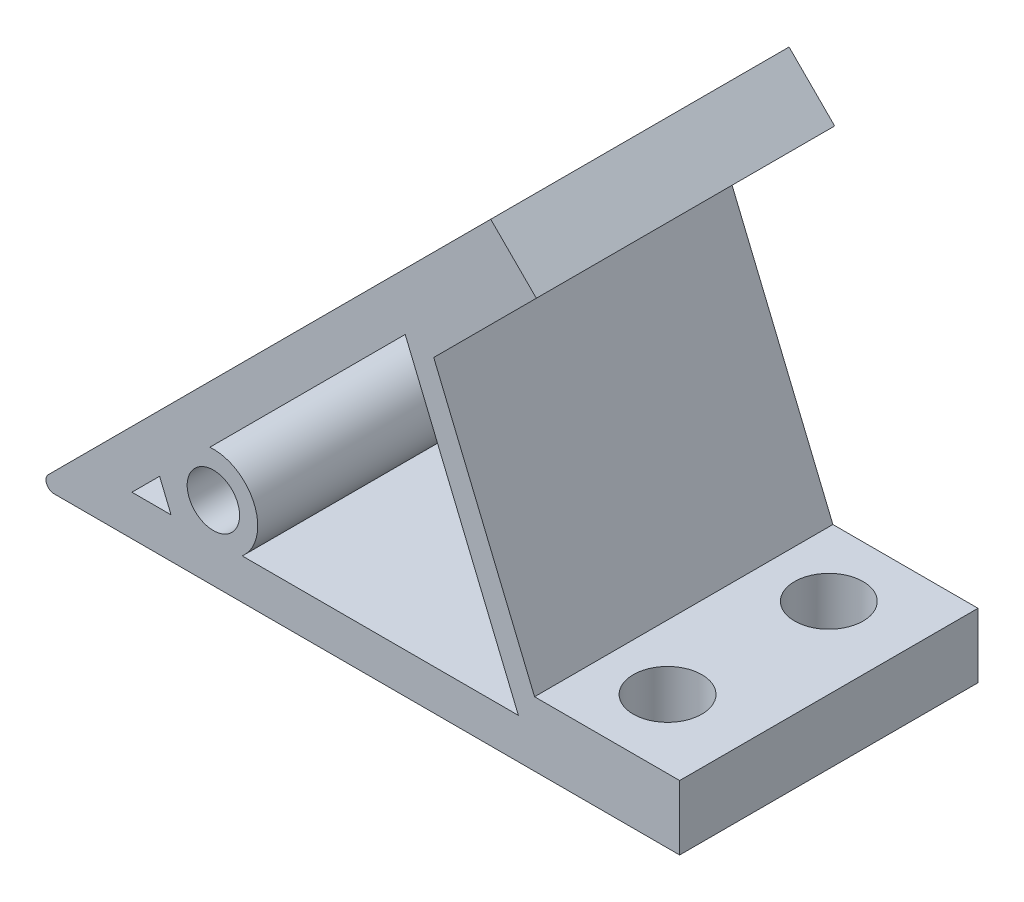
from build123d import *

# Parameters (mm, degrees)
SKETCH_1_R          = 3.25
EXTRUDE_1_DEPTH     = 18.5
SKETCH_3_R          = 4.25
CUT_EXTRUDE_1_DEPTH = 17


with BuildPart() as part:
    # 草图1 → 凸台-拉伸1 (new, symmetric)
    with BuildSketch(Plane.XY):
        with BuildLine():
            Line((-77.585786438, 0), (0, 0))
            Line((0, 0), (0, 8))
            Line((0, 8), (-17.995464086, 8))
            Line((-17.995464086, 8), (-30.499317942, 38.186973559))
            Line((-30.499317942, 38.186973559), (-17.774603256, 50.911688245))
            Line((-17.774603256, 50.911688245), (-23.431457505, 56.568542495))
            Line((-23.431457505, 56.568542495), (-78.292893219, 1.707106781))
            ThreePointArc((-78.292893219, 1.707106781), (-78.50966597, 0.617316568), (-77.585786438, 0))
        make_face()
        with Locations((-57.82689122, 9.184402377)):
            Circle(SKETCH_1_R, mode=Mode.SUBTRACT)
        Polygon((-67.928932188, 5), (-63.07447047, 5), (-64.496309389, 8.4326228), align=None, mode=Mode.SUBTRACT)
        with BuildLine():
            Line((-54.257468753, 5), (-20, 5))
            Line((-20, 5), (-34.038059223, 38.890872965))
            Line((-34.038059223, 38.890872965), (-58.261747684, 14.667184504))
            ThreePointArc((-58.261747684, 14.667184504), (-52.745553791, 11.289161255), (-54.257468753, 5))
        make_face(mode=Mode.SUBTRACT)
    extrude(amount=EXTRUDE_1_DEPTH, both=True)

    # 草图3 → 切除-拉伸1 (cut)
    with BuildSketch(Plane(origin=(0, 8, 0), x_dir=(1, 0, 0), z_dir=(0, 1, 0))):
        with Locations(Location((-10, -10, 0), (0, 0, 180))):
            Circle(SKETCH_3_R)
        with Locations(Location((-10, 10, 0), (0, 0, 270))):
            Circle(SKETCH_3_R)
    cut_extrude_1 = extrude(amount=-CUT_EXTRUDE_1_DEPTH, mode=Mode.SUBTRACT)

    # 镜向1: 切除-拉伸1 across plane
    add(cut_extrude_1.mirror(Plane(origin=(-11.715728753, 28.284271247, 0), x_dir=(0, 0, 1), z_dir=(-0.3826834323650881, 0.9238795325112875, 0))), mode=Mode.SUBTRACT)


solid = part.part
